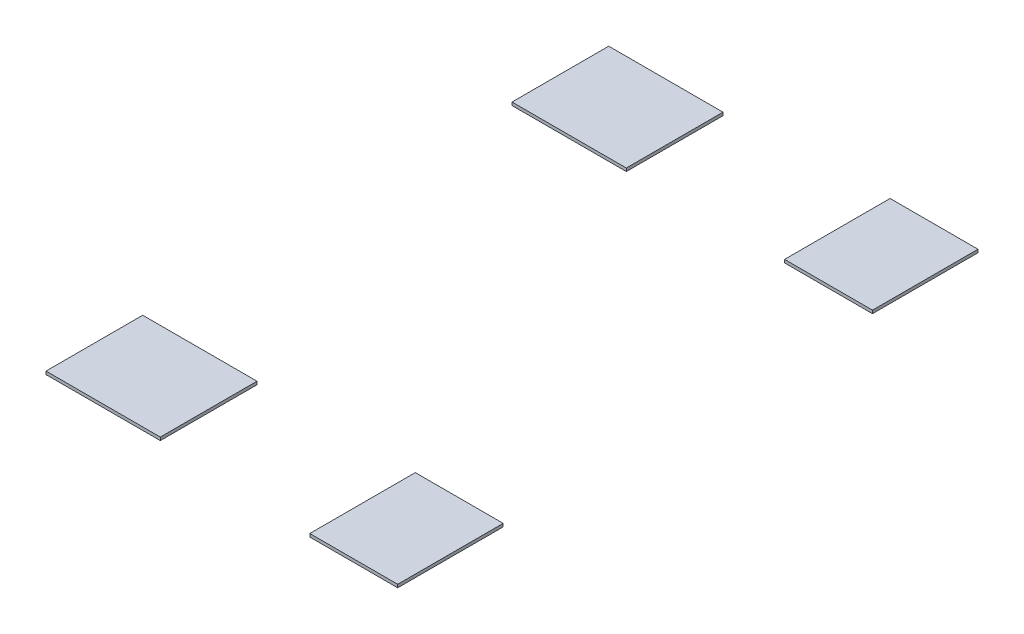
from build123d import *

# Parameters (mm, degrees)
SKETCH2_W             = 1
SKETCH2_H             = 1.2
BOSS_EXTRUDE1_DEPTH   = 0.035
SKETCH2_W_2           = 1.3
SKETCH2_H_2           = 1.1
BOSS_EXTRUDE1_2_DEPTH = 0.035
BOSS_EXTRUDE1_3_DEPTH = 0.035
BOSS_EXTRUDE1_4_DEPTH = 0.035


with BuildPart() as part:
    # Sketch2 → Boss-Extrude1 (new body)
    with BuildSketch(Plane(origin=(0, 0, 0), x_dir=(1, 0, 0), z_dir=(0, 1, 0))):
        with Locations((1.95, 2.7)):
            Rectangle(SKETCH2_W, SKETCH2_H)
    extrude(amount=BOSS_EXTRUDE1_DEPTH)


with BuildPart() as body_2:
    # Sketch2 → Boss-Extrude1 2 (new body)
    with BuildSketch(Plane(origin=(0, 0, 0), x_dir=(1, 0, 0), z_dir=(0, 1, 0))):
        with Locations((-1, 2.65)):
            Rectangle(SKETCH2_W_2, SKETCH2_H_2)
    extrude(amount=BOSS_EXTRUDE1_2_DEPTH)


with BuildPart() as body_3:
    # Sketch2 → Boss-Extrude1 3 (new body)
    with BuildSketch(Plane(origin=(0, 0, 0), x_dir=(1, 0, 0), z_dir=(0, 1, 0))):
        with Locations((1.95, -2.7)):
            Rectangle(SKETCH2_W, SKETCH2_H)
    extrude(amount=BOSS_EXTRUDE1_3_DEPTH)


with BuildPart() as body_4:
    # Sketch2 → Boss-Extrude1 4 (new body)
    with BuildSketch(Plane(origin=(0, 0, 0), x_dir=(1, 0, 0), z_dir=(0, 1, 0))):
        with Locations((-1, -2.65)):
            Rectangle(SKETCH2_W_2, SKETCH2_H_2)
    extrude(amount=BOSS_EXTRUDE1_4_DEPTH)


solid = Compound([part.part, body_2.part, body_3.part, body_4.part])
